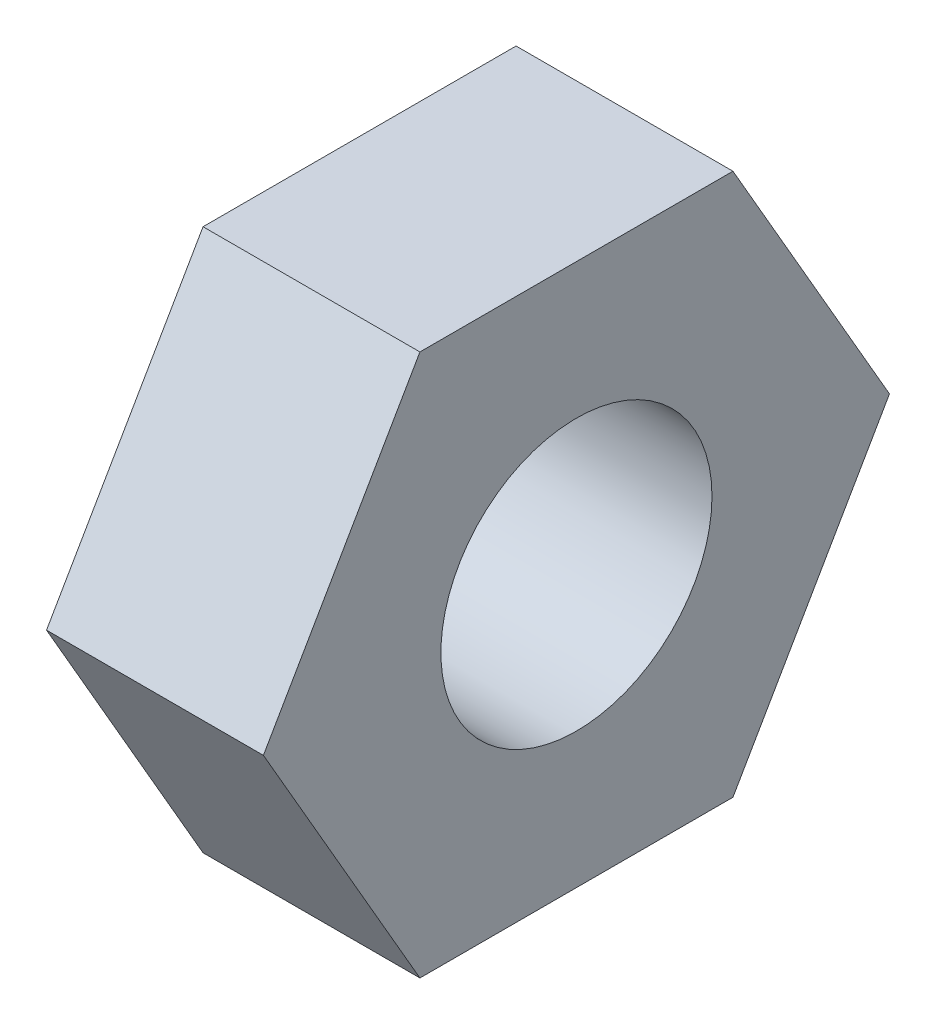
from build123d import *

# Parameters (mm, degrees)
HEX_2_DEPTH   = 2
BORE_SKETCH_W = 4
BORE_SKETCH_H = 1.25


with BuildPart() as part:
    # Hex Sketch → Hex 2 (new body)
    with BuildSketch(Plane(origin=(0, 0, 0), x_dir=(0, 0, -1), z_dir=(1, 0, 0))):
        Polygon((2.886751346, 0), (1.443375673, 2.5), (-1.443375673, 2.5), (-2.886751346, 0), (-1.443375673, -2.5), (1.443375673, -2.5), align=None)
    extrude(amount=HEX_2_DEPTH)

    # Bore Sketch → Bore (revolve, cut)
    with BuildSketch(Plane.XY):
        with Locations((1, 0.625)):
            Rectangle(BORE_SKETCH_W, BORE_SKETCH_H)
    revolve(axis=Axis((-400, 0, 0), (1, 0, 0)), mode=Mode.SUBTRACT)


solid = part.part
